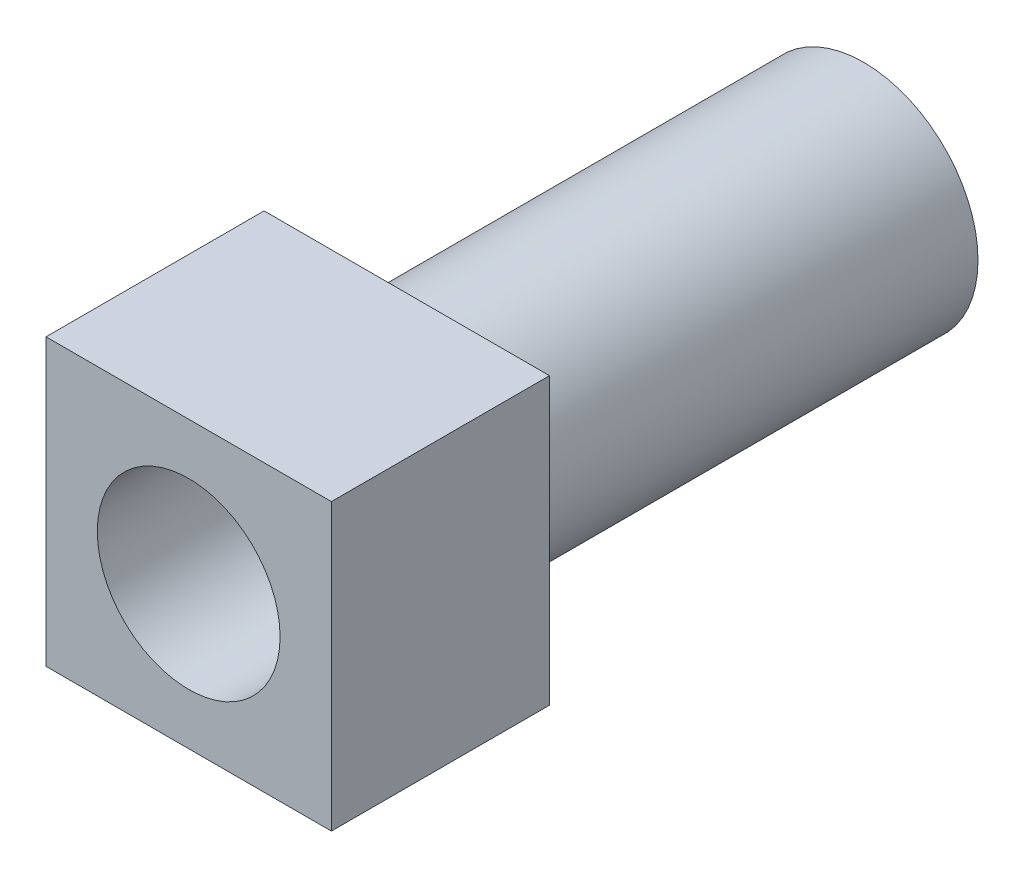
from build123d import *

# Parameters (mm, degrees)
ESQUISSE1_W             = 13.74
ESQUISSE1_H             = 13.74
BOSS_EXTRU_1_DEPTH      = 10.5
ESQUISSE3_R             = 4.4
ENL_V_MAT_EXTRU_2_DEPTH = 10
ESQUISSE8_R             = 5.5
BOSS_EXTRU_2_DEPTH      = 22
ESQUISSE2_R             = 2.8
ENL_V_MAT_EXTRU_3_DEPTH = 22
BOSS_EXTRU_3_DEPTH      = 22


with BuildPart() as part:
    # Esquisse1 → Boss.-Extru.1 (new body)
    with BuildSketch(Plane.XY):
        with Locations((-30.186071131, 8.6104)):
            Rectangle(ESQUISSE1_W, ESQUISSE1_H)
    extrude(amount=BOSS_EXTRU_1_DEPTH)

    # Esquisse3 → Enlèv. mat.-Extru.2 (cut)
    with BuildSketch(Plane.XY.offset(10.5)):
        with Locations((-30.186071131, 8.6104)):
            Circle(ESQUISSE3_R)
    extrude(amount=-ENL_V_MAT_EXTRU_2_DEPTH, mode=Mode.SUBTRACT)

    # Esquisse8 → Boss.-Extru.2 (add)
    with BuildSketch(Plane(origin=(0, 0, 0), x_dir=(-1, 0, 0), z_dir=(0, 0, -1))):
        with Locations(Location((30.186071131, 8.6104, 0), (0, 0, 180))):
            Circle(ESQUISSE8_R)
    extrude(amount=BOSS_EXTRU_2_DEPTH)

    # Esquisse2 → Enlèv. mat.-Extru.3 (cut)
    with BuildSketch(Plane(origin=(0, 0, 0), x_dir=(-1, 0, 0), z_dir=(0, 0, -1))):
        with Locations((30.186071131, 8.6104)):
            Circle(ESQUISSE2_R)
    extrude(amount=ENL_V_MAT_EXTRU_3_DEPTH, mode=Mode.SUBTRACT)

    # Esquisse9 → Boss.-Extru.3 (add)
    with BuildSketch(Plane(origin=(0, 0, -22), x_dir=(-1, 0, 0), z_dir=(0, 0, -1))):
        with BuildLine():
            Line((32.558926644, 10.096857773), (28.881418946, 11.087875061))
            ThreePointArc((28.881418946, 11.087875061), (30.919504526, 11.332054799), (32.558926644, 10.096857773))
        make_face()
    extrude(amount=-BOSS_EXTRU_3_DEPTH)


solid = part.part
